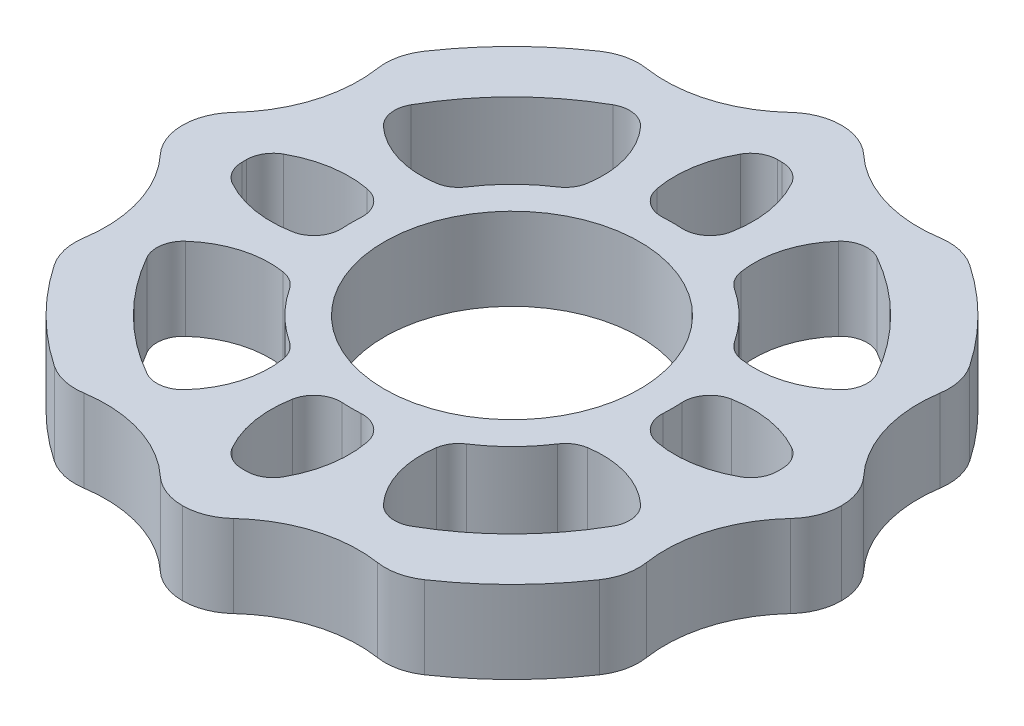
from build123d import *

# Parameters (mm, degrees)
SKIZZE1_R                       = 8
SKIZZE1_R_2                     = 3.1
AUFSATZ_LINEAR_AUSTRAGEN1_DEPTH = 2
SCHNITT_LINEAR_AUSTRAGEN1_DEPTH = 12.489125293
SCHNITT_LINEAR_AUSTRAGEN2_DEPTH = 12.489125293
SCHNITT_LINEAR_AUSTRAGEN3_DEPTH = 12.489125293
KREISMUSTER1_COUNT              = 4
VERRUNDUNG2_R                   = 0.65
VERRUNDUNG3_R                   = 1.3


with BuildPart() as part:
    # Skizze1 → Aufsatz-Linear austragen1 (new body)
    with BuildSketch(Plane(origin=(0, 0, 0), x_dir=(1, 0, 0), z_dir=(0, 1, 0))):
        with Locations(Location((0, 0, 0), (0, 0, 270))):
            Circle(SKIZZE1_R)
        with Locations(Location((0, 0, 0), (0, 0, 270))):
            Circle(SKIZZE1_R_2, mode=Mode.SUBTRACT)
    extrude(amount=AUFSATZ_LINEAR_AUSTRAGEN1_DEPTH)

    # Skizze2 → Schnitt-Linear austragen1 (cut, through all)
    with BuildSketch(Plane(origin=(0, 2, 0), x_dir=(1, 0, 0), z_dir=(0, 1, 0))):
        with BuildLine():
            ThreePointArc((0.409400899, 6.48709418), (0, 6.5), (-0.409400899, 6.48709418))
            ThreePointArc((-0.409400899, 6.48709418), (-0.932280658, 5.20302905), (-0.72088108, 3.83279669))
            ThreePointArc((-0.72088108, 3.83279669), (0, 3.9), (0.72088108, 3.83279669))
            ThreePointArc((0.72088108, 3.83279669), (0.932280658, 5.20302905), (0.409400899, 6.48709418))
        make_face()
    schnitt_linear_austragen1 = extrude(amount=-SCHNITT_LINEAR_AUSTRAGEN1_DEPTH, mode=Mode.SUBTRACT)

    # Skizze3 → Schnitt-Linear austragen2 (cut, through all)
    with BuildSketch(Plane(origin=(0, 2, 0), x_dir=(1, 0, 0), z_dir=(0, 1, 0))):
        with BuildLine():
            ThreePointArc((3.386082754, 1.93505648), (2.757716447, 2.757716447), (1.93505648, 3.386082754))
            ThreePointArc((1.93505648, 3.386082754), (1.956663272, 4.768811084), (2.795836596, 5.867989241))
            ThreePointArc((2.795836596, 5.867989241), (4.596194078, 4.596194078), (5.867989241, 2.795836596))
            ThreePointArc((5.867989241, 2.795836596), (4.768811084, 1.956663272), (3.386082754, 1.93505648))
        make_face()
    schnitt_linear_austragen2 = extrude(amount=-SCHNITT_LINEAR_AUSTRAGEN2_DEPTH, mode=Mode.SUBTRACT)

    # Skizze4 → Schnitt-Linear austragen3 (cut, through all)
    with BuildSketch(Plane(origin=(0, 2, 0), x_dir=(1, 0, 0), z_dir=(0, 1, 0))):
        with BuildLine():
            ThreePointArc((-4.002321515, 6.926862384), (-2.131523451, 6.93178358), (-0.581188372, 7.978860826))
            ThreePointArc((-0.581188372, 7.978860826), (-2.351343425, 7.646645284), (-4.002321515, 6.926862384))
        make_face()
        with BuildLine():
            ThreePointArc((0.581188372, 7.978860826), (2.131523451, 6.93178358), (4.002321515, 6.926862384))
            ThreePointArc((4.002321515, 6.926862384), (2.351343425, 7.646645284), (0.581188372, 7.978860826))
        make_face()
    schnitt_linear_austragen3 = extrude(amount=-SCHNITT_LINEAR_AUSTRAGEN3_DEPTH, mode=Mode.SUBTRACT)

    # Kreismuster1: Schnitt-Linear austragen1, Schnitt-Linear austragen2, Schnitt-Linear austragen3 ×4 about axis
    kreismuster1_axis = Axis((0, 0, 0), (0, 1, 0))
    add([schnitt_linear_austragen1.rotate(kreismuster1_axis, i * 360 / KREISMUSTER1_COUNT) for i in range(1, KREISMUSTER1_COUNT)], mode=Mode.SUBTRACT)
    add([schnitt_linear_austragen2.rotate(kreismuster1_axis, i * 360 / KREISMUSTER1_COUNT) for i in range(1, KREISMUSTER1_COUNT)], mode=Mode.SUBTRACT)
    add([schnitt_linear_austragen3.rotate(kreismuster1_axis, i * 360 / KREISMUSTER1_COUNT) for i in range(1, KREISMUSTER1_COUNT)], mode=Mode.SUBTRACT)

    # Verrundung2
    verrundung2_edges = [part.edges().sort_by_distance(p)[0] for p in [
        (-3.386082754, 1, -1.93505648),
        (-5.867989241, 1, -2.795836596),
        (-2.795836596, 1, -5.867989241),
        (-1.93505648, 1, -3.386082754),
        (-1.93505648, 1, 3.386082754),
        (-2.795836596, 1, 5.867989241),
        (-5.867989241, 1, 2.795836596),
        (-3.386082754, 1, 1.93505648),
        (3.386082754, 1, 1.93505648),
        (5.867989241, 1, 2.795836596),
        (2.795836596, 1, 5.867989241),
        (1.93505648, 1, 3.386082754),
        (-0.72088108, 1, -3.83279669),
        (-0.409400899, 1, -6.48709418),
        (0.409400899, 1, -6.48709418),
        (0.72088108, 1, -3.83279669),
        (1.93505648, 1, -3.386082754),
        (2.795836596, 1, -5.867989241),
        (5.867989241, 1, -2.795836596),
        (3.386082754, 1, -1.93505648),
        (-3.83279669, 1, 0.72088108),
        (-6.48709418, 1, 0.409400899),
        (-6.48709418, 1, -0.409400899),
        (-3.83279669, 1, -0.72088108),
        (0.72088108, 1, 3.83279669),
        (0.409400899, 1, 6.48709418),
        (-0.409400899, 1, 6.48709418),
        (-0.72088108, 1, 3.83279669),
        (3.83279669, 1, -0.72088108),
        (6.48709418, 1, -0.409400899),
        (6.48709418, 1, 0.409400899),
        (3.83279669, 1, 0.72088108),
    ]]
    fillet(verrundung2_edges, radius=VERRUNDUNG2_R)

    # Verrundung3
    verrundung3_edges = [part.edges().sort_by_distance(p)[0] for p in [
        (6.926862384, 1, -4.002321515),
        (7.978860826, 1, -0.581188372),
        (7.978860826, 1, 0.581188372),
        (6.926862384, 1, 4.002321515),
        (4.002321515, 1, 6.926862384),
        (0.581188372, 1, 7.978860826),
        (-0.581188372, 1, 7.978860826),
        (-4.002321515, 1, 6.926862384),
        (-6.926862384, 1, 4.002321515),
        (-7.978860826, 1, 0.581188372),
        (-7.978860826, 1, -0.581188372),
        (-6.926862384, 1, -4.002321515),
        (0.581188372, 1, -7.978860826),
        (4.002321515, 1, -6.926862384),
        (-4.002321515, 1, -6.926862384),
        (-0.581188372, 1, -7.978860826),
    ]]
    fillet(verrundung3_edges, radius=VERRUNDUNG3_R)


solid = part.part
